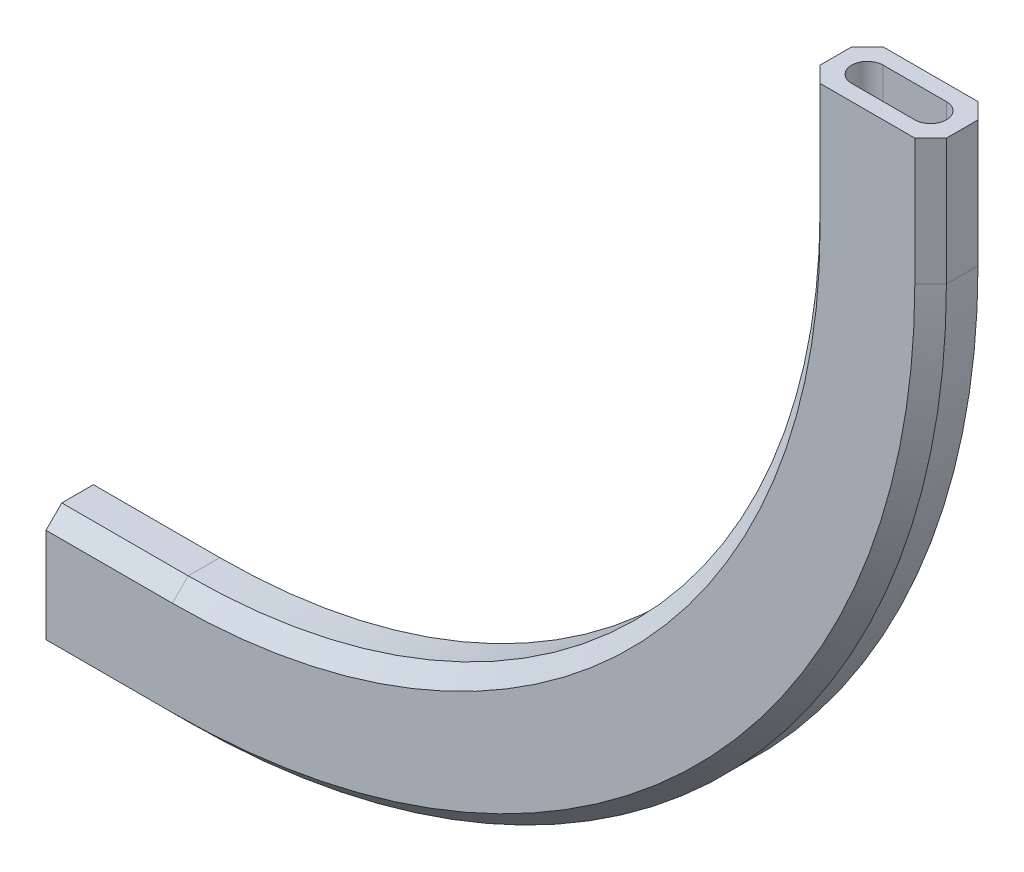
from build123d import *

# Parameters (mm, degrees)
BOSS_EXTRUDE1_DEPTH = 6.35
CUT_EXTRUDE2_DEPTH  = 12.7
CUT_EXTRUDE3_DEPTH  = 12.7
CHAMFER2_SIZE       = 1.5875


with BuildPart() as part:
    # Sketch1 → Boss-Extrude1 (new body)
    with BuildSketch(Plane.XY):
        with BuildLine():
            Line((0, 0), (12.7, 0))
            ThreePointArc((12.7, 0), (57.601280605, 18.598719395), (76.2, 63.5))
            Line((76.2, 63.5), (76.2, 76.2))
            Line((76.2, 76.2), (88.9, 76.2))
            Line((88.9, 76.2), (88.9, 63.5))
            ThreePointArc((88.9, 63.5), (66.581536726, 9.618463274), (12.7, -12.7))
            Line((12.7, -12.7), (0, -12.7))
            Line((0, -12.7), (0, 0))
        make_face()
    extrude(amount=BOSS_EXTRUDE1_DEPTH)

    # Sketch2 → Cut-Extrude2 (cut)
    with BuildSketch(Plane(origin=(0, 76.2, 0), x_dir=(1, 0, 0), z_dir=(0, 1, 0))):
        with BuildLine():
            Line((79.375, -1.5875), (85.725, -1.5875))
            ThreePointArc((85.725, -1.5875), (87.3125, -3.175), (85.725, -4.7625))
            Line((85.725, -4.7625), (79.375, -4.7625))
            ThreePointArc((79.375, -4.7625), (77.7875, -3.175), (79.375, -1.5875))
        make_face()
    extrude(amount=-CUT_EXTRUDE2_DEPTH, mode=Mode.SUBTRACT)

    # Sketch4 → Cut-Extrude3 (cut)
    with BuildSketch(Plane.ZY):
        with BuildLine():
            Line((4.7625, -3.175), (4.7625, -9.525))
            ThreePointArc((4.7625, -9.525), (3.175, -11.1125), (1.5875, -9.525))
            Line((1.5875, -9.525), (1.5875, -3.175))
            ThreePointArc((1.5875, -3.175), (3.175, -1.5875), (4.7625, -3.175))
        make_face()
    extrude(amount=-CUT_EXTRUDE3_DEPTH, mode=Mode.SUBTRACT)

    # Chamfer2
    chamfer2_edges = [part.edges().sort_by_distance(p)[0] for p in [
        (66.581536726, 9.618463274, 6.35),
        (6.35, -12.7, 0),
        (88.9, 69.85, 6.35),
        (76.2, 69.85, 6.35),
        (57.601280605, 18.598719395, 6.35),
        (6.35, 0, 6.35),
        (6.35, -12.7, 6.35),
        (6.35, 0, 0),
        (57.601280605, 18.598719395, 0),
        (76.2, 69.85, 0),
        (88.9, 69.85, 0),
        (66.581536726, 9.618463274, 0),
    ]]
    chamfer(chamfer2_edges, length=CHAMFER2_SIZE)


solid = part.part
